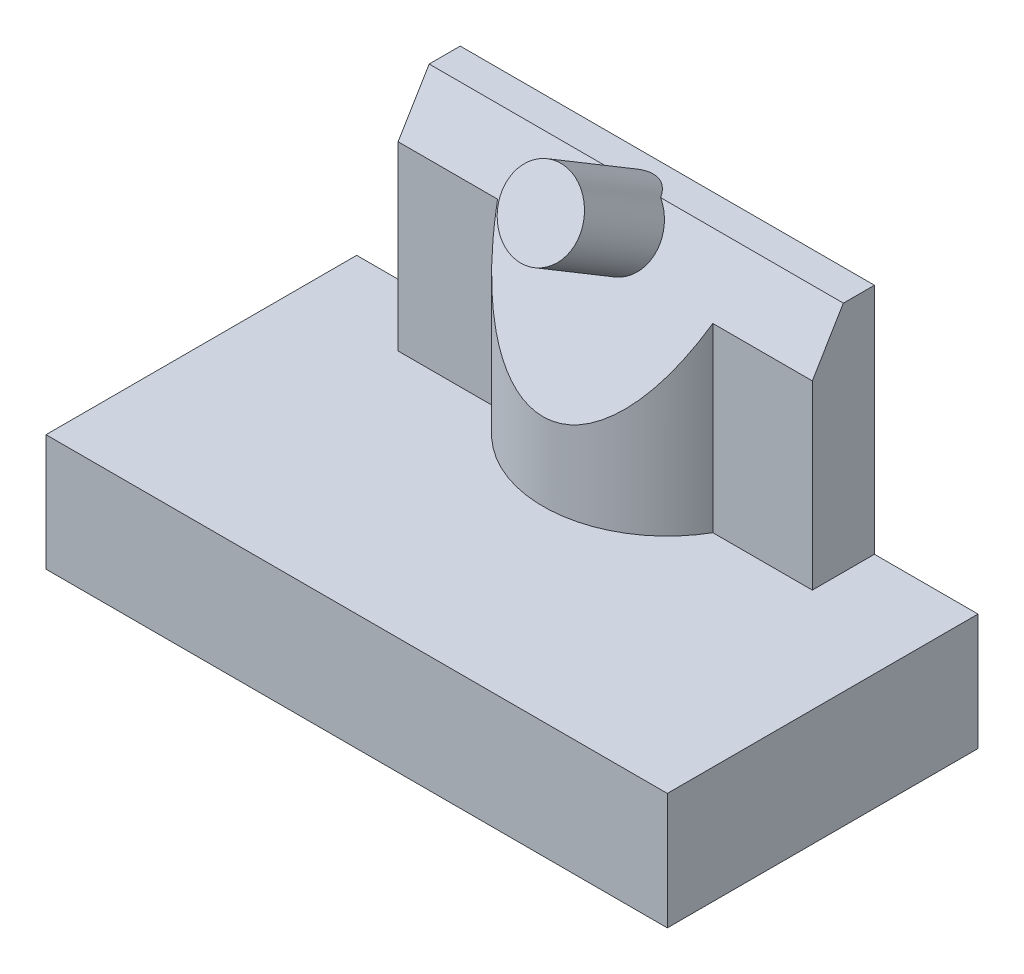
from build123d import *

# Parameters (mm, degrees)
SKETCH1_W                       = 120
SKETCH1_H                       = 60
BOSS_EXTRUDE1_DEPTH             = 22.5
SHELL1_T                        = -1
BOSS_EXTRUDE2_DEPTH             = 45
CUT_EXTRUDE1_DEPTH              = 125.323167592
BOSS_EXTRUDE3_REACH             = 96.877
SKETCH8_R                       = 7.5
BOSS_EXTRUDE3_DIRECTION_2_DEPTH = 18


with BuildPart() as part:
    # Sketch1 → Boss-Extrude1 (new body)
    with BuildSketch(Plane(origin=(0, 0, 0), x_dir=(1, 0, 0), z_dir=(0, 1, 0))):
        Rectangle(SKETCH1_W, SKETCH1_H)
    extrude(amount=BOSS_EXTRUDE1_DEPTH)

    # Shell1
    shell1_openings = [part.faces().sort_by_distance(p)[0] for p in [
        (0, 0, 0),
    ]]
    offset(amount=SHELL1_T, openings=shell1_openings, kind=Kind.INTERSECTION)

    # Sketch2 → Boss-Extrude2 (add)
    with BuildSketch(Plane(origin=(0, 22.5, 0), x_dir=(1, 0, 0), z_dir=(0, 1, 0))):
        with BuildLine():
            Line((-40, 30), (40, 30))
            Line((40, 30), (40, 18))
            Line((40, 18), (20.787496232, 18))
            ThreePointArc((20.787496232, 18), (0, 5.997500139), (-20.787496232, 18))
            Line((-20.787496232, 18), (-40, 18))
            Line((-40, 18), (-40, 30))
        make_face()
    extrude(amount=BOSS_EXTRUDE2_DEPTH)

    # Sketch3 → Cut-Extrude1 (cut, through all)
    with BuildSketch(Plane(origin=(40, 0, 0), x_dir=(0, 0, -1), z_dir=(1, 0, 0))):
        Polygon((24, 67.5), (5.997500139, 67.5), (5.997500139, 37.5), align=None)
    extrude(amount=-CUT_EXTRUDE1_DEPTH, mode=Mode.SUBTRACT)

    # Sketch8 → Boss-Extrude3 (add, up to next)
    with BuildSketch(Plane(origin=(0, 7.282369087, 12.135596405), x_dir=(1, 0, 0), z_dir=(0, 0.514548292074691, 0.8574614015353803)), mode=Mode.PRIVATE) as boss_extrude3_sk1:
        with Locations((0, 64.397447073)):
            Circle(SKETCH8_R)
    boss_extrude3_tool1 = extrude(boss_extrude3_sk1.sketch, amount=-BOSS_EXTRUDE3_REACH, mode=Mode.PRIVATE) - part.part
    add(boss_extrude3_tool1.solids().sort_by_distance((0, 62.500694, -21))[0])

    # Sketch8 → Boss-Extrude3 direction 2 (add)
    with BuildSketch(Plane(origin=(0, 7.282369087, 12.135596405), x_dir=(1, 0, 0), z_dir=(0, 0.514548292074691, 0.8574614015353803))):
        with Locations((0, 64.397447073)):
            Circle(SKETCH8_R)
    extrude(amount=BOSS_EXTRUDE3_DIRECTION_2_DEPTH)


solid = part.part
